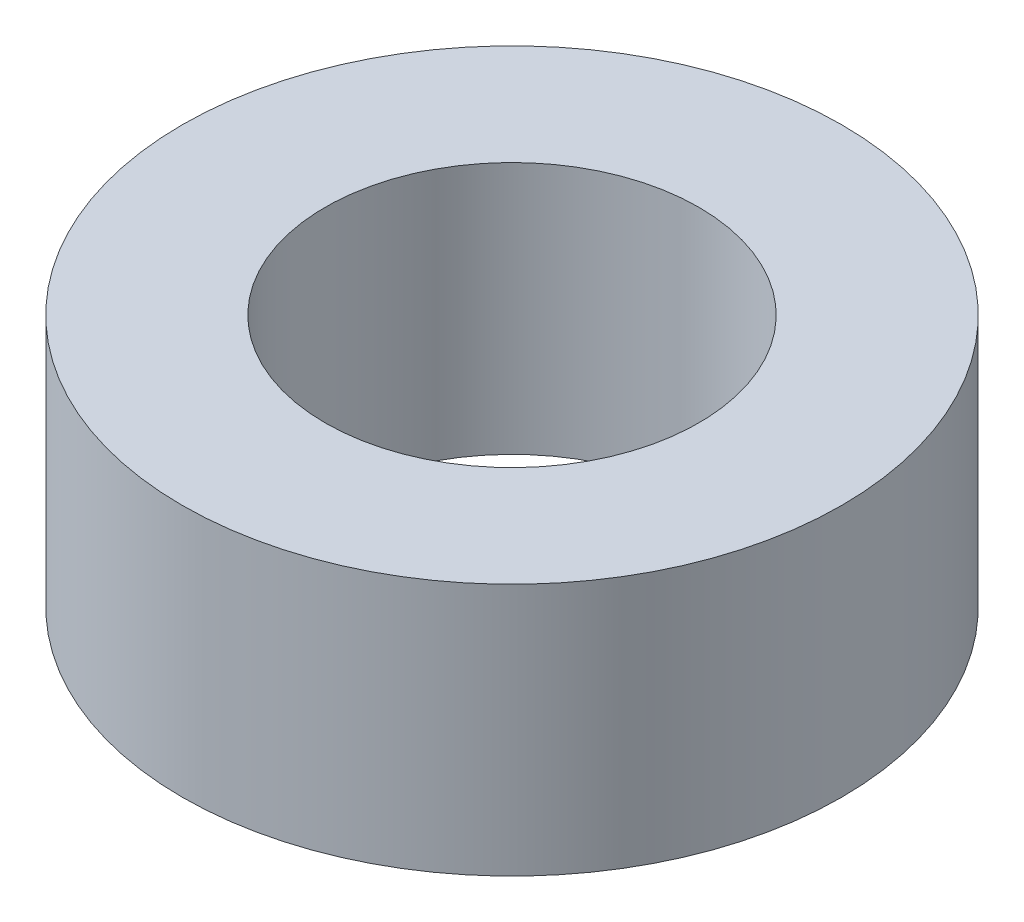
from build123d import *

# Parameters (mm, degrees)
SKETCH1_R           = 3
SKETCH1_R_2         = 1.7
BOSS_EXTRUDE1_DEPTH = 1.15


with BuildPart() as part:
    # Sketch1 → Boss-Extrude1 (new, symmetric)
    with BuildSketch(Plane(origin=(0, 0, 0), x_dir=(1, 0, 0), z_dir=(0, 1, 0))):
        with Locations(Location((0, 0, 0), (0, 0, 270))):
            Circle(SKETCH1_R)
        with Locations(Location((0, 0, 0), (0, 0, 270))):
            Circle(SKETCH1_R_2, mode=Mode.SUBTRACT)
    extrude(amount=BOSS_EXTRUDE1_DEPTH, both=True)


solid = part.part
